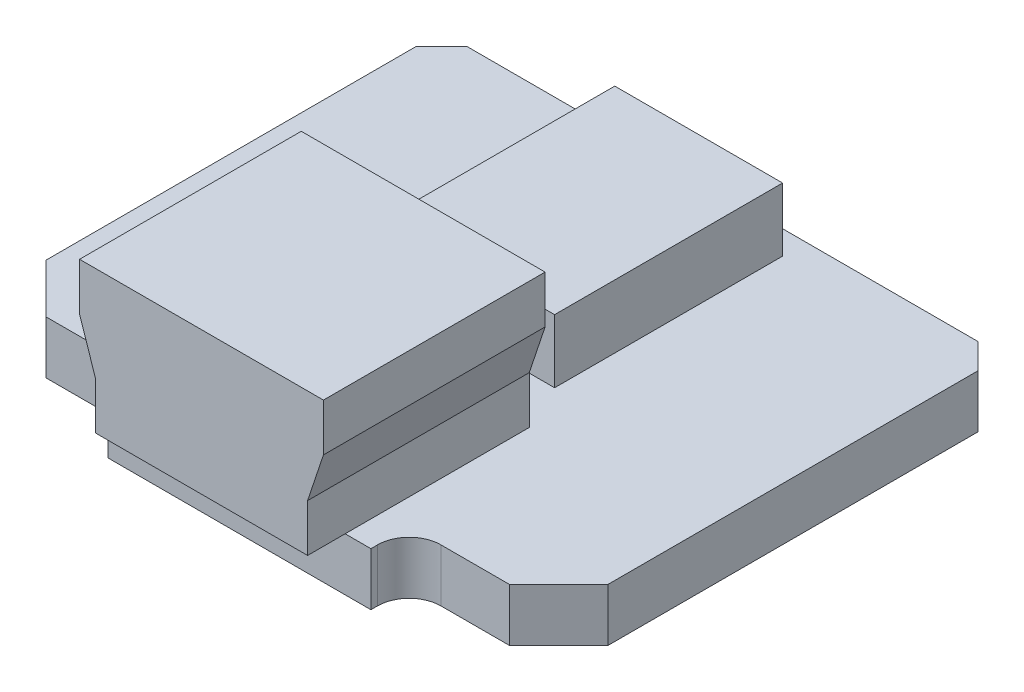
from build123d import *

# Parameters (mm, degrees)
PCB_DEPTH           = 1.67
SKETCH2_W           = 5.3
SKETCH2_H           = 7.2
PIC18_DEPTH         = 2
CRYSTAL_DEPTH       = 0.72
BOSS_EXTRUDE4_DEPTH = 2.5
USB_CONNECTOR_DEPTH = 7


with BuildPart() as part:
    # PCB Sketch → PCB (new body)
    with BuildSketch(Plane(origin=(0, 0, 0), x_dir=(1, 0, 0), z_dir=(0, 1, 0))):
        with BuildLine():
            Line((-8.07, 7.625), (8.07, 7.625))
            Line((8.07, 7.625), (8.87, 6.825))
            Line((8.87, 6.825), (8.87, -4.865))
            Line((8.87, -4.865), (7.32, -6.415))
            Line((7.32, -6.415), (5.15, -6.415))
            ThreePointArc((5.15, -6.415), (4.442893219, -6.707893219), (4.15, -7.415))
            Line((4.15, -7.415), (4.15, -7.625))
            Line((4.15, -7.625), (-4.15, -7.625))
            Line((-4.15, -7.625), (-4.15, -7.415))
            ThreePointArc((-4.15, -7.415), (-4.442893219, -6.707893219), (-5.15, -6.415))
            Line((-5.15, -6.415), (-7.32, -6.415))
            Line((-7.32, -6.415), (-8.87, -4.865))
            Line((-8.87, -4.865), (-8.87, 6.825))
            Line((-8.87, 6.825), (-8.07, 7.625))
        make_face()
    extrude(amount=PCB_DEPTH)

    # Sketch2 → PIC18 (add)
    with BuildSketch(Plane(origin=(0, 1.67, 0), x_dir=(1, 0, 0), z_dir=(0, 1, 0))):
        with Locations((0, 3.275)):
            Rectangle(SKETCH2_W, SKETCH2_H)
    extrude(amount=PIC18_DEPTH)

    # Sketch3 → Crystal (add)
    with BuildSketch(Plane.XZ):
        with BuildLine():
            Line((-3.81, 1.585), (-3.81, -4.795))
            ThreePointArc((-3.81, -4.795), (-6.04, -7.025), (-8.27, -4.795))
            Line((-8.27, -4.795), (-8.27, 1.585))
            ThreePointArc((-8.27, 1.585), (-6.04, 3.815), (-3.81, 1.585))
        make_face()
    extrude(amount=CRYSTAL_DEPTH)

    # Sketch5 → Boss-Extrude4 (add)
    with BuildSketch(Plane.XZ.offset(0.72)):
        with BuildLine():
            Line((-4.255, 1.585), (-4.255, -4.715))
            ThreePointArc((-4.255, -4.715), (-6.04, -6.5), (-7.825, -4.715))
            Line((-7.825, -4.715), (-7.825, 1.585))
            ThreePointArc((-7.825, 1.585), (-6.04, 3.37), (-4.255, 1.585))
        make_face()
    extrude(amount=BOSS_EXTRUDE4_DEPTH)


with BuildPart() as body_2:
    # 3DSketch1 → USB Connector (new body)
    with BuildSketch(Plane(origin=(-3.849621322, 6.184444439, 1.825), x_dir=(0.847998304005088, -0.52999894000318, 0), z_dir=(0, 0, 1))):
        Polygon((0, 0), (6.529586941, 4.080991838), (7.324585351, 2.808994382), (7.695584609, 1.271997456), (8.490583019, 0), (2.808994382, -3.550992898), (2.013995972, -2.278995442), (0.79499841, -1.271997456), align=None)
    extrude(amount=USB_CONNECTOR_DEPTH)


solid = Compound([part.part, body_2.part])
